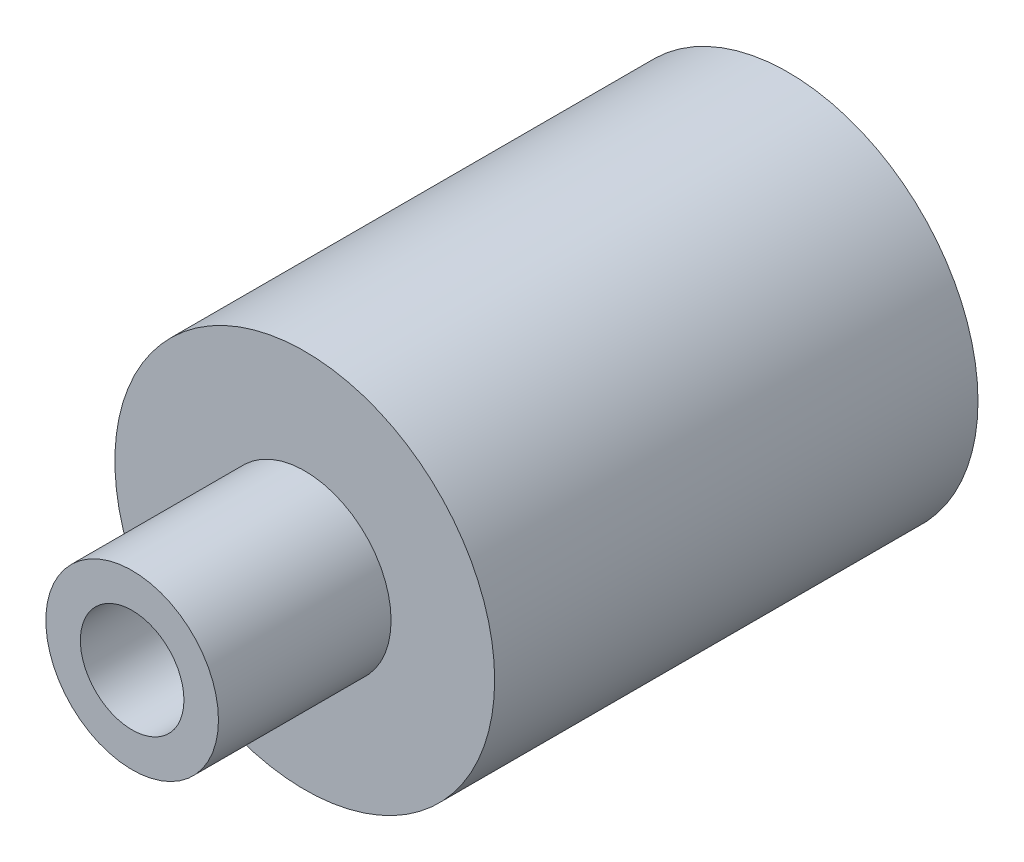
from build123d import *


with BuildPart() as part:
    # Эскиз1 → Повернуть1 (revolve)
    with BuildSketch(Plane(origin=(0, 0, 0), x_dir=(0, 0, -1), z_dir=(1, 0, 0)), mode=Mode.PRIVATE) as revolve_1_sk:
        Polygon((28, 11), (0, 11), (0, 5), (-10, 5), (-10, 3), (2, 3), (2, 8), (23, 8), (23, 10), (28, 10), align=None)
    revolve(revolve_1_sk.sketch.rotate(Axis((0, 0, 28.642974124), (0, 0, -1)), 90), axis=Axis((0, 0, 28.642974124), (0, 0, -1)))


solid = part.part
